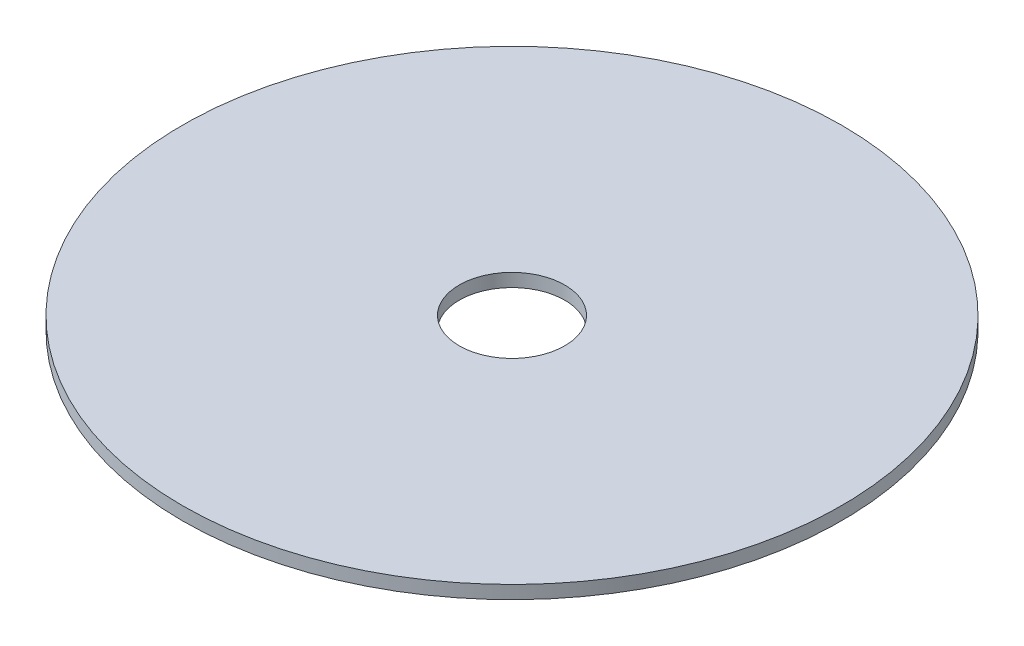
from build123d import *

# Parameters (mm, degrees)
SKETCH1_R           = 37.5
SKETCH1_R_2         = 6
BOSS_EXTRUDE1_DEPTH = 1.5


with BuildPart() as part:
    # Sketch1 → Boss-Extrude1 (new body)
    with BuildSketch(Plane(origin=(0, 0, 0), x_dir=(1, 0, 0), z_dir=(0, 1, 0))):
        with Locations(Location((0, 0, 0), (0, 0, 270))):
            Circle(SKETCH1_R)
        with Locations(Location((0, 0, 0), (0, 0, 270))):
            Circle(SKETCH1_R_2, mode=Mode.SUBTRACT)
    extrude(amount=BOSS_EXTRUDE1_DEPTH)


solid = part.part
